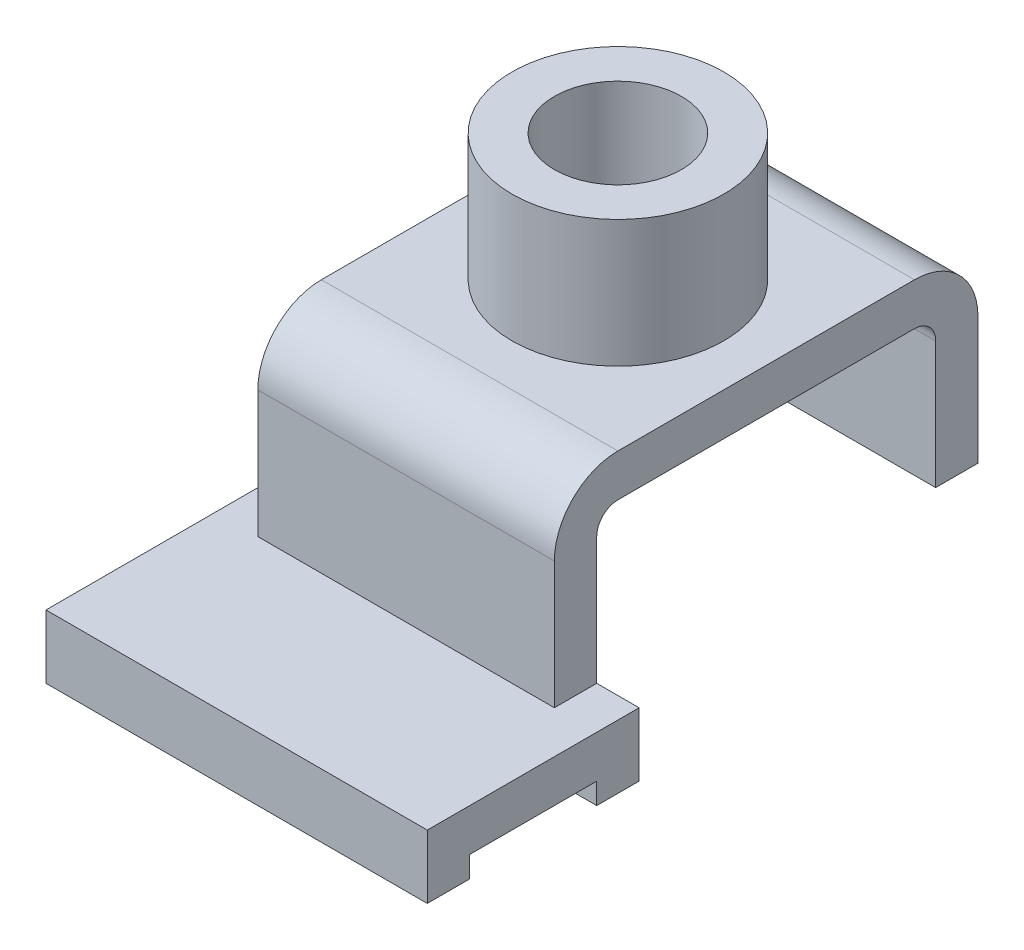
from build123d import *

# Parameters (mm, degrees)
BOSS_EXTRUDE1_DEPTH = 45
BOSS_EXTRUDE2_START = -10
BOSS_EXTRUDE2_DEPTH = 70
SKETCH3_R           = 25
SKETCH3_R_2         = 15
BOSS_EXTRUDE3_DEPTH = 30


with BuildPart() as part:
    # Sketch1 → Boss-Extrude1 (new, symmetric)
    with BuildSketch(Plane(origin=(0, 0, 0), x_dir=(0, 0, -1), z_dir=(1, 0, 0))):
        Polygon((-20.642857143, -6.642857143), (-30.642857143, -6.642857143), (-30.642857143, 8.357142857), (19.357142857, 8.357142857), (19.357142857, -6.642857143), (9.357142857, -6.642857143), (9.357142857, -1.642857143), (-20.642857143, -1.642857143), align=None)
    extrude(amount=BOSS_EXTRUDE1_DEPTH, both=True)

    # Sketch2 → Boss-Extrude2 (add)
    with BuildSketch(Plane(origin=(45, 0, 0), x_dir=(0, 0, -1), z_dir=(1, 0, 0)).offset(BOSS_EXTRUDE2_START)):
        with BuildLine():
            Line((19.357142857, 8.357142857), (19.357142857, 38.357142857))
            ThreePointArc((19.357142857, 38.357142857), (20.821608951, 41.892676763), (24.357142857, 43.357142857))
            Line((24.357142857, 43.357142857), (94.357142857, 43.357142857))
            ThreePointArc((94.357142857, 43.357142857), (97.892676763, 41.892676763), (99.357142857, 38.357142857))
            Line((99.357142857, 38.357142857), (99.357142857, 8.357142857))
            Line((99.357142857, 8.357142857), (109.357142857, 8.357142857))
            Line((109.357142857, 8.357142857), (109.357142857, 38.357142857))
            ThreePointArc((109.357142857, 38.357142857), (104.963744575, 48.963744575), (94.357142857, 53.357142857))
            Line((94.357142857, 53.357142857), (24.357142857, 53.357142857))
            ThreePointArc((24.357142857, 53.357142857), (13.750541139, 48.963744575), (9.357142857, 38.357142857))
            Line((9.357142857, 38.357142857), (9.357142857, 8.357142857))
            Line((9.357142857, 8.357142857), (19.357142857, 8.357142857))
        make_face()
    extrude(amount=-BOSS_EXTRUDE2_DEPTH)

    # Sketch3 → Boss-Extrude3 (add)
    with BuildSketch(Plane(origin=(0, 53.357142857, 0), x_dir=(1, 0, 0), z_dir=(0, 1, 0))):
        with Locations(Location((0, 59.357142857, 0), (0, 0, 270))):
            Circle(SKETCH3_R)
        with Locations(Location((0, 59.357142857, 0), (0, 0, 270))):
            Circle(SKETCH3_R_2, mode=Mode.SUBTRACT)
    extrude(amount=BOSS_EXTRUDE3_DEPTH)


solid = part.part
